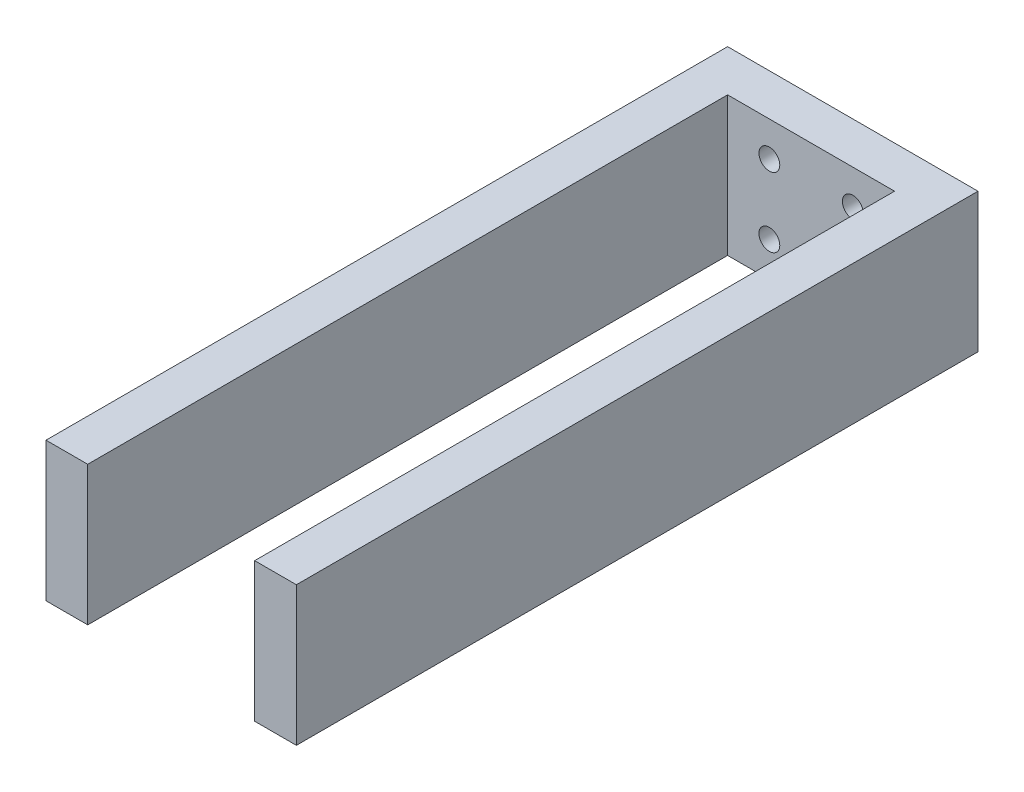
from build123d import *

# Parameters (mm, degrees)
SKETCH_1_W      = 36
SKETCH_1_H      = 20
SKETCH_1_R      = 1.5
EXTRUDE_1_DEPTH = 6
SKETCH_1_3_W    = 6
SKETCH_1_3_H    = 20
EXTRUDE_2_DEPTH = 98


with BuildPart() as part:
    # Эскиз1 → Бобышка-Вытянуть1 (new body)
    with BuildSketch(Plane.XY):
        Rectangle(SKETCH_1_W, SKETCH_1_H)
        with Locations((6, 5)):
            Circle(SKETCH_1_R, mode=Mode.SUBTRACT)
        with Locations((-6, -5)):
            Circle(SKETCH_1_R, mode=Mode.SUBTRACT)
        with Locations((6, -5)):
            Circle(SKETCH_1_R, mode=Mode.SUBTRACT)
        with Locations((-6, 5)):
            Circle(SKETCH_1_R, mode=Mode.SUBTRACT)
    extrude(amount=EXTRUDE_1_DEPTH)

    # Эскиз1<3> → Бобышка-Вытянуть2 (add)
    with BuildSketch(Plane.XY):
        with Locations((-15, 0)):
            Rectangle(SKETCH_1_3_W, SKETCH_1_3_H)
        with Locations((15, 0)):
            Rectangle(SKETCH_1_3_W, SKETCH_1_3_H)
    extrude(amount=EXTRUDE_2_DEPTH)


solid = part.part
